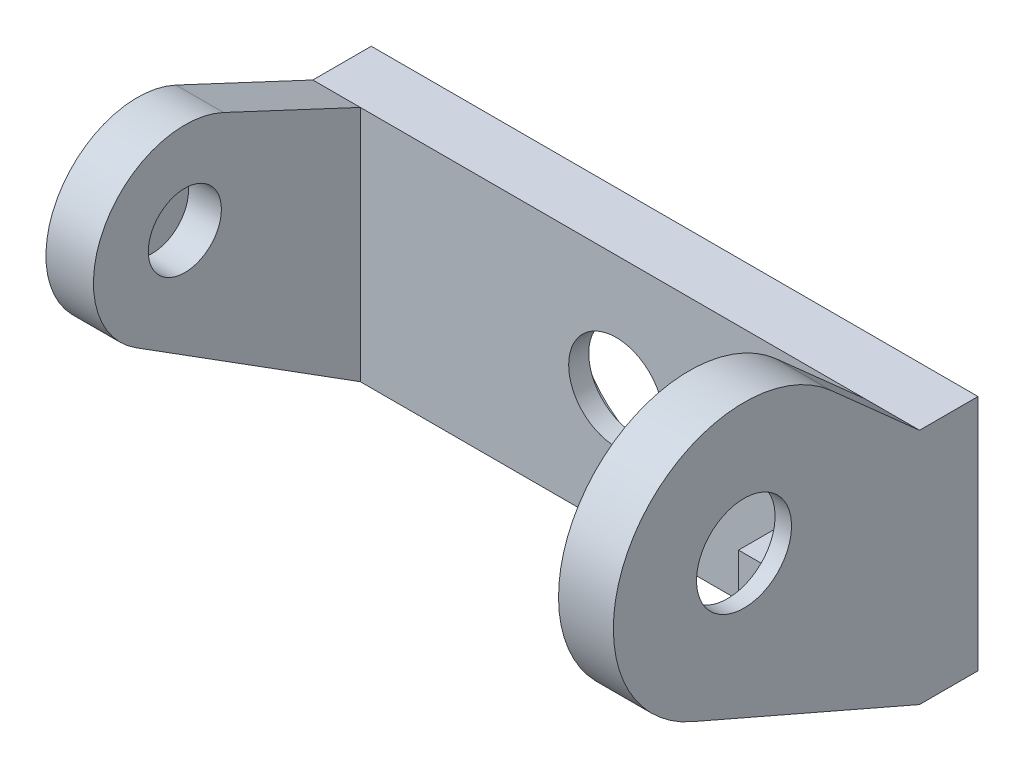
from build123d import *

# Parameters (mm, degrees)
EXTRUDE_1_DEPTH     = 3.2
EXTRUDE_2_DEPTH     = 2.6
EXTRUDE_3_DEPTH     = 3
CUT_EXTRUDE_1_DEPTH = 2.1
SKETCH_5_R          = 2.6
CUT_EXTRUDE_2_DEPTH = 1.1
CUT_EXTRUDE_3_DEPTH = 2.1
SKETCH_7_R          = 2.6
CUT_EXTRUDE_4_DEPTH = 0.9
SKETCH_8_R          = 2
CUT_EXTRUDE_5_DEPTH = 1.8


with BuildPart() as part:
    # ｽｹｯﾁ1 → ﾎﾞｽ - 押し出し1 (new body)
    with BuildSketch(Plane.XY):
        Polygon((0, 0), (13.621587752, 0), (19.578412248, 0), (33.2, 0), (33.2, 13.000240072), (19.578412248, 13.000240072), (13.621587752, 13.000240072), (0, 13.000240072), align=None)
    extrude(amount=EXTRUDE_1_DEPTH)

    # ｽｹｯﾁ2 → ﾎﾞｽ - 押し出し2 (add)
    with BuildSketch(Plane.ZY):
        with BuildLine():
            Line((3.199725342, 0), (15.472038891, 7.74466563))
            ThreePointArc((15.472038891, 7.74466563), (17.190896421, 14.371374104), (10.684882054, 16.501987504))
            Line((10.684882054, 16.501987504), (3.199725342, 13.000240072))
            Line((3.199725342, 13.000240072), (3.199725342, 0))
        make_face()
    extrude(amount=-EXTRUDE_2_DEPTH)

    # ｽｹｯﾁ3 → ﾎﾞｽ - 押し出し3 (add)
    with BuildSketch(Plane(origin=(33.2, 0, 0), x_dir=(0, 0, -1), z_dir=(1, 0, 0))):
        with BuildLine():
            Line((-3.199725342, 13.000240072), (-8.051923005, 17.315733546))
            ThreePointArc((-8.051923005, 17.315733546), (-18.828777882, 15.822754082), (-15.654913036, 5.416209475))
            Line((-15.654913036, 5.416209475), (-3.199725342, 0))
            Line((-3.199725342, 0), (-3.199725342, 13.000240072))
        make_face()
    extrude(amount=-EXTRUDE_3_DEPTH)

    # ｽｹｯﾁ4 → ｶｯﾄ - 押し出し1 (cut)
    with BuildSketch(Plane(origin=(0, 0, 0), x_dir=(-1, 0, 0), z_dir=(0, 0, -1))):
        with BuildLine():
            Line((-21.832955241, 8.023343606), (-20.309731671, 6.500120036))
            Line((-20.309731671, 6.500120036), (-21.832955241, 4.976896465))
            ThreePointArc((-21.832955241, 4.976896465), (-20.45383125, 2.646288786), (-18.12322357, 1.267164795))
            Line((-18.12322357, 1.267164795), (-16.6, 2.790388365))
            Line((-16.6, 2.790388365), (-15.07677643, 1.267164795))
            ThreePointArc((-15.07677643, 1.267164795), (-12.74616875, 2.646288786), (-11.367044759, 4.976896465))
            Line((-11.367044759, 4.976896465), (-12.890268329, 6.500120036))
            Line((-12.890268329, 6.500120036), (-11.367044759, 8.023343606))
            ThreePointArc((-11.367044759, 8.023343606), (-12.74616875, 10.353951285), (-15.07677643, 11.733075277))
            Line((-15.07677643, 11.733075277), (-16.6, 10.209851706))
            Line((-16.6, 10.209851706), (-18.12322357, 11.733075277))
            ThreePointArc((-18.12322357, 11.733075277), (-20.45383125, 10.353951285), (-21.832955241, 8.023343606))
        make_face()
    extrude(amount=-CUT_EXTRUDE_1_DEPTH, mode=Mode.SUBTRACT)

    # ｽｹｯﾁ5 → ｶｯﾄ - 押し出し2 (cut)
    with BuildSketch(Plane(origin=(0, 0, 2.1), x_dir=(-1, 0, 0), z_dir=(0, 0, -1))):
        with Locations((-16.6, 6.500120036)):
            Circle(SKETCH_5_R)
    extrude(amount=-CUT_EXTRUDE_2_DEPTH, mode=Mode.SUBTRACT)

    # ｽｹｯﾁ6 → ｶｯﾄ - 押し出し3 (cut)
    with BuildSketch(Plane.ZY.offset(-30.2)):
        with BuildLine():
            Line((15.503618238, 7.124116138), (15.503618238, 9.2730851))
            Line((15.503618238, 9.2730851), (17.6525872, 9.2730851))
            ThreePointArc((17.6525872, 9.2730851), (18.353618238, 11.9730851), (17.6525872, 14.6730851))
            Line((17.6525872, 14.6730851), (15.503618238, 14.6730851))
            Line((15.503618238, 14.6730851), (15.503618238, 16.822054063))
            ThreePointArc((15.503618238, 16.822054063), (12.803618238, 17.5230851), (10.103618238, 16.822054063))
            Line((10.103618238, 16.822054063), (10.103618238, 14.6730851))
            Line((10.103618238, 14.6730851), (7.954649275, 14.6730851))
            ThreePointArc((7.954649275, 14.6730851), (7.253618238, 11.9730851), (7.954649275, 9.2730851))
            Line((7.954649275, 9.2730851), (10.103618238, 9.2730851))
            Line((10.103618238, 9.2730851), (10.103618238, 7.124116138))
            ThreePointArc((10.103618238, 7.124116138), (12.803618238, 6.4230851), (15.503618238, 7.124116138))
        make_face()
    extrude(amount=-CUT_EXTRUDE_3_DEPTH, mode=Mode.SUBTRACT)

    # ｽｹｯﾁ7 → ｶｯﾄ - 押し出し4 (cut)
    with BuildSketch(Plane.ZY.offset(-32.3)):
        with Locations((12.803618238, 11.9730851)):
            Circle(SKETCH_7_R)
    extrude(amount=-CUT_EXTRUDE_4_DEPTH, mode=Mode.SUBTRACT)

    # ｽｹｯﾁ8 → ｶｯﾄ - 押し出し5 (cut)
    with BuildSketch(Plane(origin=(2.6, 0, 0), x_dir=(0, 0, -1), z_dir=(1, 0, 0))):
        with Locations((-12.803618238, 11.9730851)):
            Circle(SKETCH_8_R)
    extrude(amount=-CUT_EXTRUDE_5_DEPTH, mode=Mode.SUBTRACT)


solid = part.part
